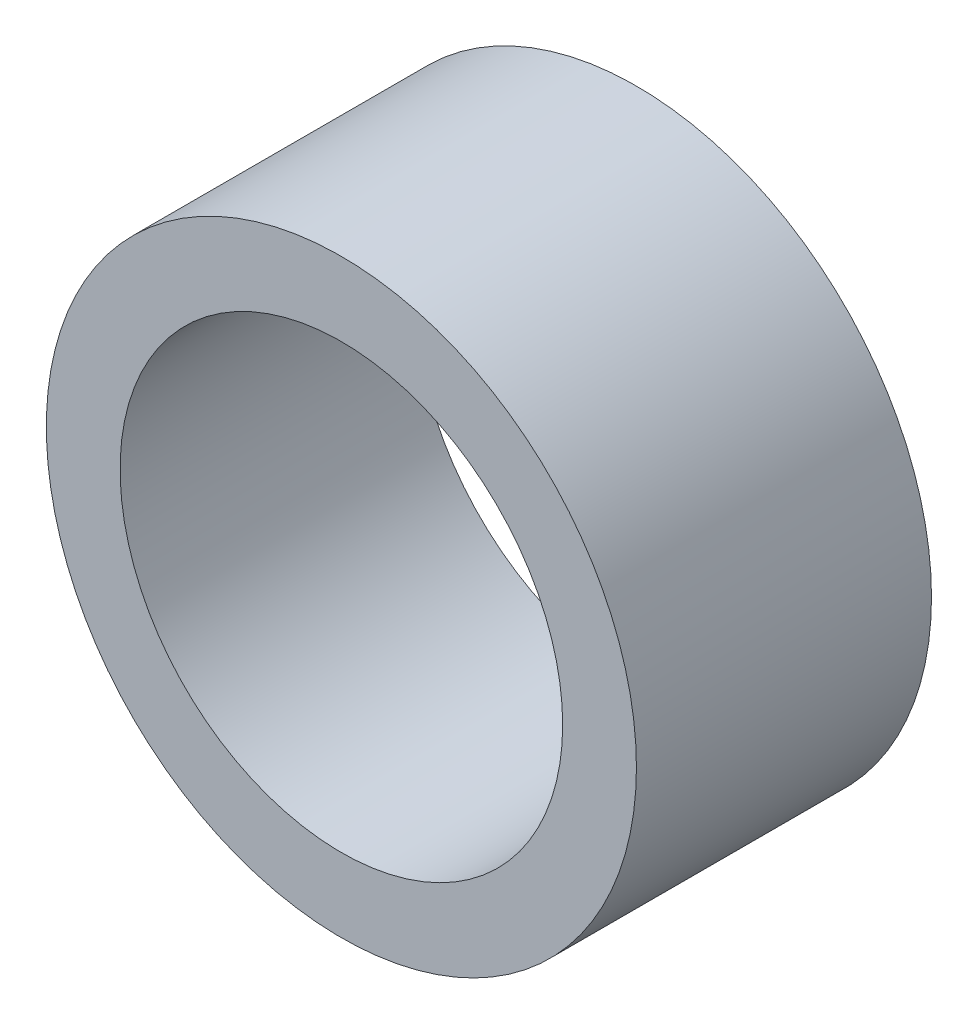
from build123d import *

# Parameters (mm, degrees)
IZIM1_R                     = 40
IZIM1_R_2                   = 30
Y_KSEKLIK_EKSTR_ZYON1_DEPTH = 40


with BuildPart() as part:
    # Çizim1 → Yükseklik-Ekstrüzyon1 (new body)
    with BuildSketch(Plane.XY):
        Circle(IZIM1_R)
        Circle(IZIM1_R_2, mode=Mode.SUBTRACT)
    extrude(amount=Y_KSEKLIK_EKSTR_ZYON1_DEPTH)


solid = part.part
